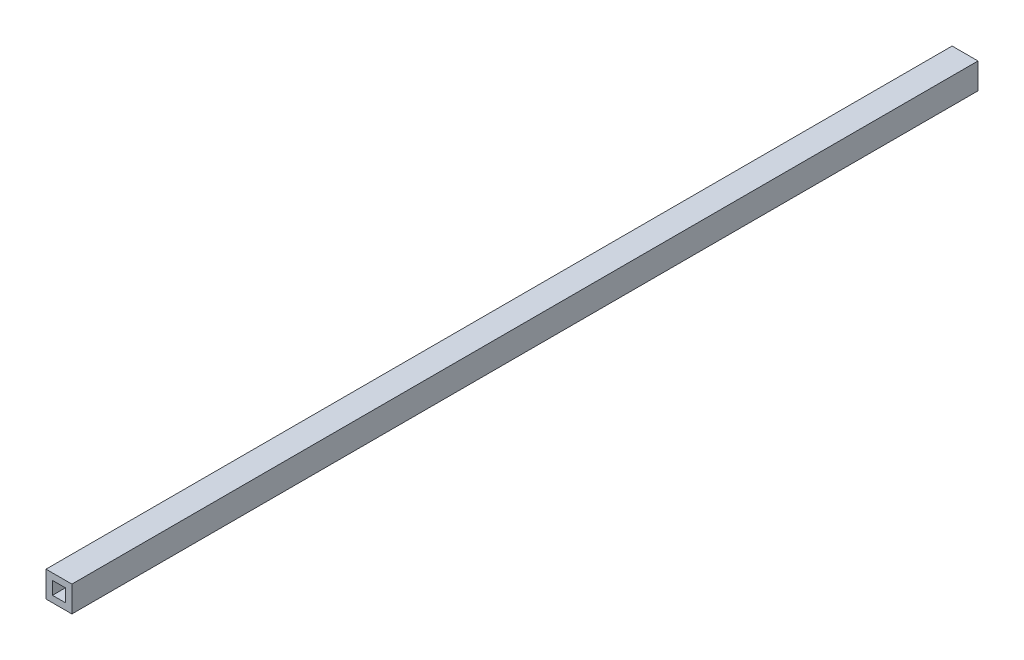
from build123d import *

# Parameters (mm, degrees)
SKETCH1_W           = 20
SKETCH1_H           = 20
SKETCH1_W_2         = 10
SKETCH1_H_2         = 10
EXTRUDE_THIN1_DEPTH = 700


with BuildPart() as part:
    # Sketch1 → Extrude-Thin1 (new body)
    with BuildSketch(Plane.XY):
        Rectangle(SKETCH1_W, SKETCH1_H)
        Rectangle(SKETCH1_W_2, SKETCH1_H_2, mode=Mode.SUBTRACT)
    extrude(amount=EXTRUDE_THIN1_DEPTH)


solid = part.part
